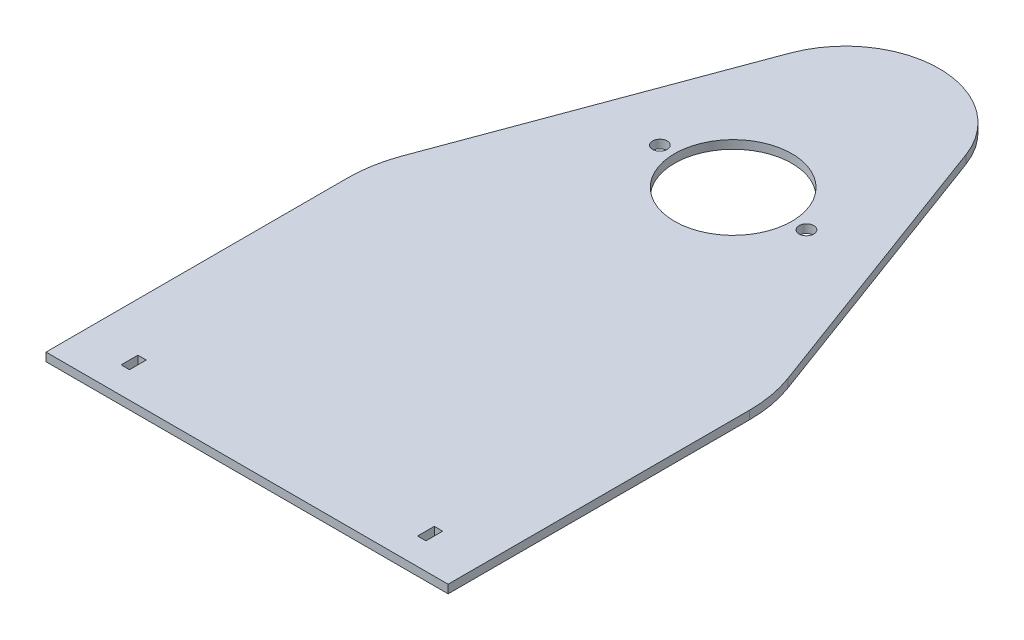
from build123d import *

# Parameters (mm, degrees)
SKETCH3_R           = 22.225
SKETCH3_R_2         = 2.778125
SKETCH3_W           = 3.175
SKETCH3_H           = 6.35
BOSS_EXTRUDE1_DEPTH = 3.175


with BuildPart() as part:
    # Sketch3 → Boss-Extrude1 (new body)
    with BuildSketch(Plane(origin=(0, 0, 0), x_dir=(1, 0, 0), z_dir=(0, 1, 0))):
        with BuildLine():
            Line((0, 0), (0, 114.3))
            ThreePointArc((0, 114.3), (0.796571799, 123.260868714), (3.161305831, 131.940714778))
            Line((3.161305831, 131.940714778), (42.852914082, 239.127776658))
            ThreePointArc((42.852914082, 239.127776658), (76.2, 262.339276313), (109.547085918, 239.127776658))
            Line((109.547085918, 239.127776658), (149.238694169, 131.940714778))
            ThreePointArc((149.238694169, 131.940714778), (151.603428201, 123.260868714), (152.4, 114.3))
            Line((152.4, 114.3), (152.4, 0))
            Line((152.4, 0), (0, 0))
        make_face()
        with Locations(Location((76.2, 184.24413735, 0), (0, 0, 270))):
            Circle(SKETCH3_R, mode=Mode.SUBTRACT)
        with Locations(Location((103.98125, 184.24413735, 0), (0, 0, 270))):
            Circle(SKETCH3_R_2, mode=Mode.SUBTRACT)
        with Locations(Location((48.41875, 184.24413735, 0), (0, 0, 90))):
            Circle(SKETCH3_R_2, mode=Mode.SUBTRACT)
        with Locations((20.0285604, 13.212735966)):
            Rectangle(SKETCH3_W, SKETCH3_H, mode=Mode.SUBTRACT)
        with Locations((132.3714396, 13.212735966)):
            Rectangle(SKETCH3_W, SKETCH3_H, mode=Mode.SUBTRACT)
    extrude(amount=BOSS_EXTRUDE1_DEPTH)


solid = part.part
